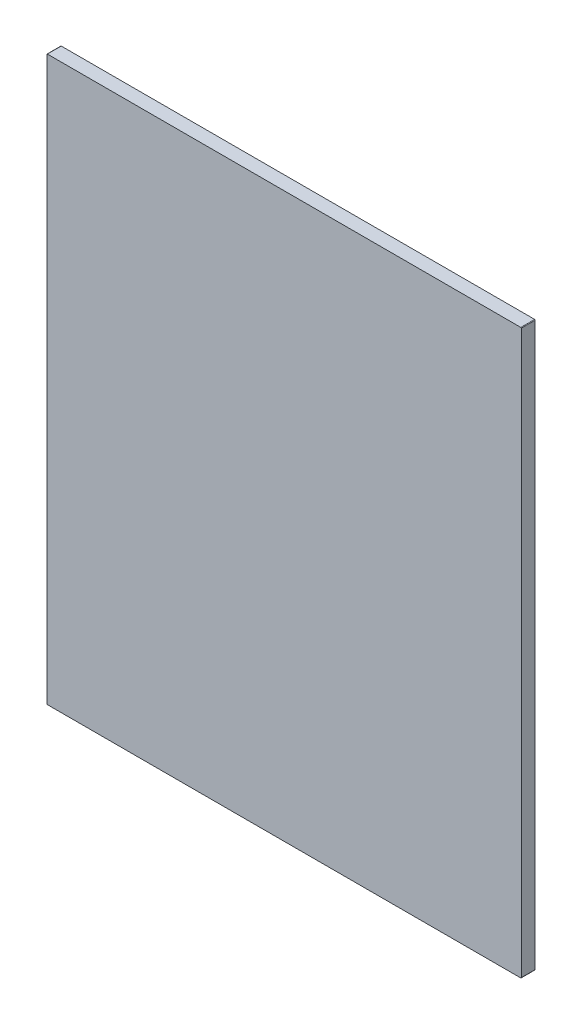
from build123d import *

# Parameters (mm, degrees)
SKETCH1_W           = 217.17
SKETCH1_H           = 257.937
BOSS_EXTRUDE3_DEPTH = 6.35
FILLET1_R           = 0.254


with BuildPart() as part:
    # Sketch1 → Boss-Extrude3 (new body)
    with BuildSketch(Plane.XY):
        with Locations((108.585, 128.9685)):
            Rectangle(SKETCH1_W, SKETCH1_H)
    extrude(amount=BOSS_EXTRUDE3_DEPTH)

    # Fillet1
    fillet1_edges = [part.edges().sort_by_distance(p)[0] for p in [
        (0, 257.937, 3.175),
        (217.17, 257.937, 3.175),
        (217.17, 0, 3.175),
        (0, 0, 3.175),
    ]]
    fillet(fillet1_edges, radius=FILLET1_R)


solid = part.part
